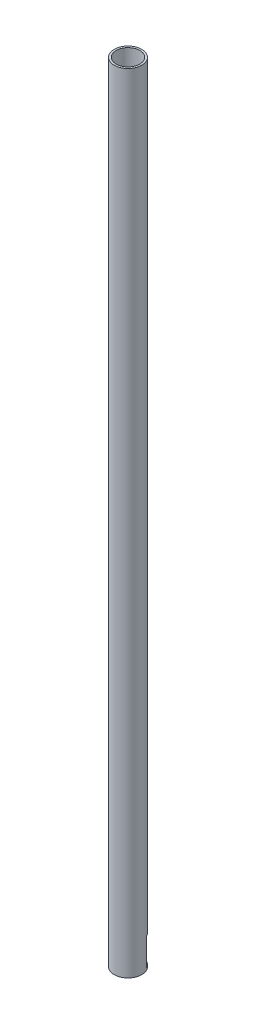
from build123d import *

# Parameters (mm, degrees)
SKETCH1_R           = 7
SKETCH1_R_2         = 6
BOSS_EXTRUDE1_DEPTH = 400
CUT_EXTRUDE1_DEPTH  = 7


with BuildPart() as part:
    # Sketch1 → Boss-Extrude1 (new body)
    with BuildSketch(Plane(origin=(0, 0, 0), x_dir=(1, 0, 0), z_dir=(0, 1, 0))):
        with Locations(Location((0, 0, 0), (0, 0, 270))):
            Circle(SKETCH1_R)
        with Locations(Location((0, 0, 0), (0, 0, 270))):
            Circle(SKETCH1_R_2, mode=Mode.SUBTRACT)
    extrude(amount=BOSS_EXTRUDE1_DEPTH)

    # Sketch3 → Cut-Extrude1 (cut)
    with BuildSketch(Plane.XY.offset(-10)):
        Polygon((-6, 15), (-6, 1), (0, 1), (8, 1), (8, 15), align=None)
    extrude(amount=CUT_EXTRUDE1_DEPTH, mode=Mode.SUBTRACT)


solid = part.part
